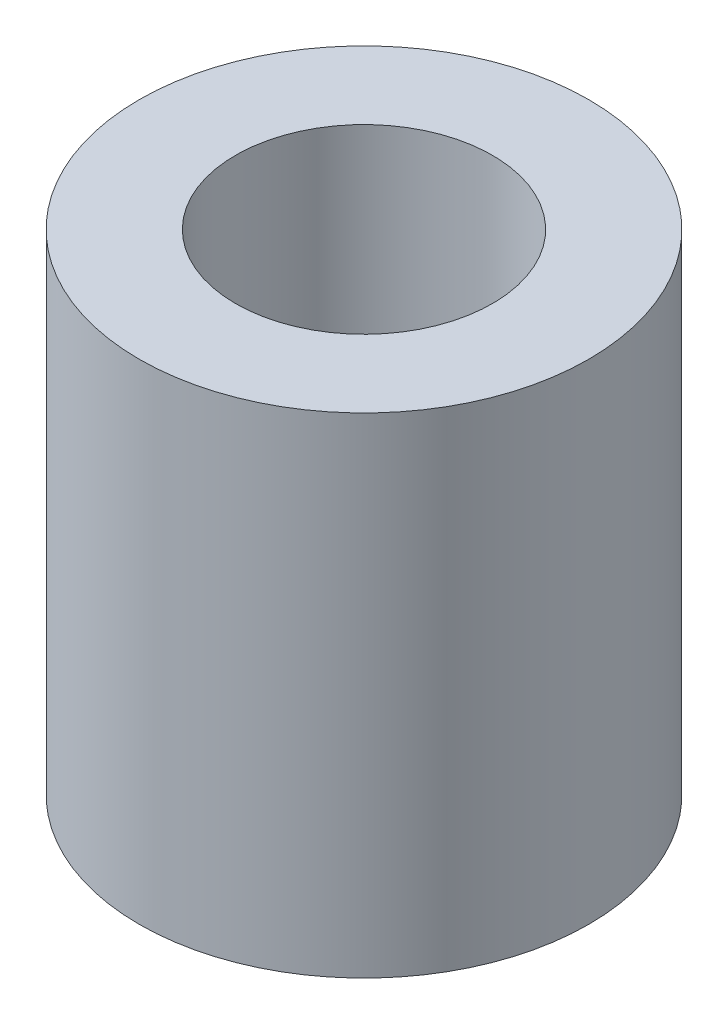
from build123d import *

# Parameters (mm, degrees)
SKETCH1_R           = 3.5
SKETCH1_R_2         = 1.999996
BOSS_EXTRUDE1_DEPTH = 7.62


with BuildPart() as part:
    # Sketch1 → Boss-Extrude1 (new body)
    with BuildSketch(Plane(origin=(0, 0, 0), x_dir=(1, 0, 0), z_dir=(0, 1, 0))):
        with Locations(Location((0, 0, 0), (0, 0, 270))):
            Circle(SKETCH1_R)
        with Locations(Location((0, 0, 0), (0, 0, 270))):
            Circle(SKETCH1_R_2, mode=Mode.SUBTRACT)
    extrude(amount=-BOSS_EXTRUDE1_DEPTH)


solid = part.part
